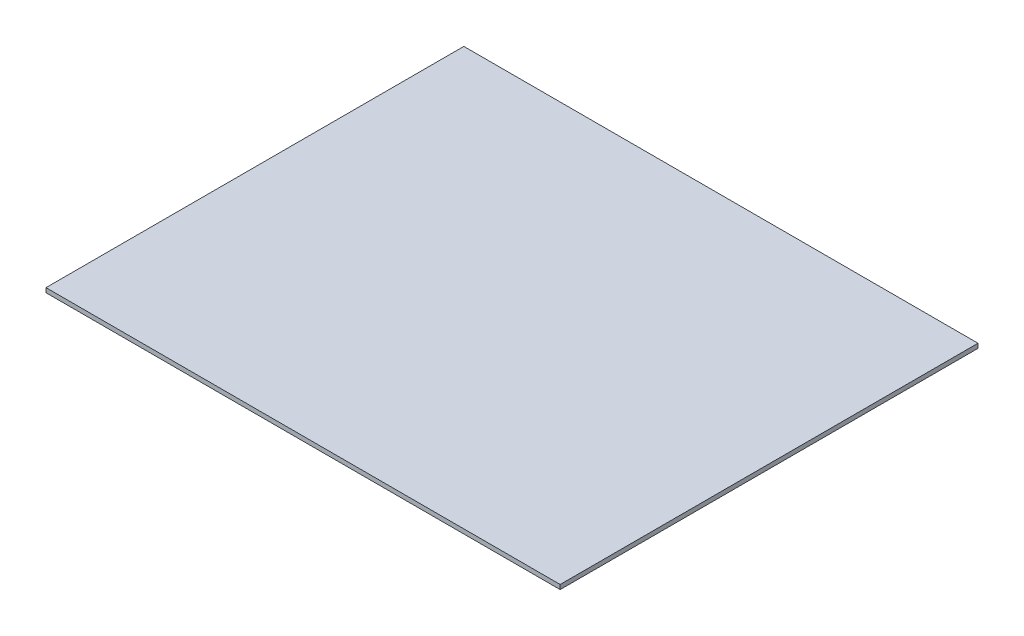
from build123d import *

# Parameters (mm, degrees)
ESBO_O1_W                = 347
ESBO_O1_H                = 282
RESSALTO_EXTRUS_O1_DEPTH = 3


with BuildPart() as part:
    # Esboço1 → Ressalto-extrusão1 (new body)
    with BuildSketch(Plane(origin=(0, 0, 0), x_dir=(1, 0, 0), z_dir=(0, 1, 0))):
        Rectangle(ESBO_O1_W, ESBO_O1_H)
    extrude(amount=RESSALTO_EXTRUS_O1_DEPTH)


solid = part.part
